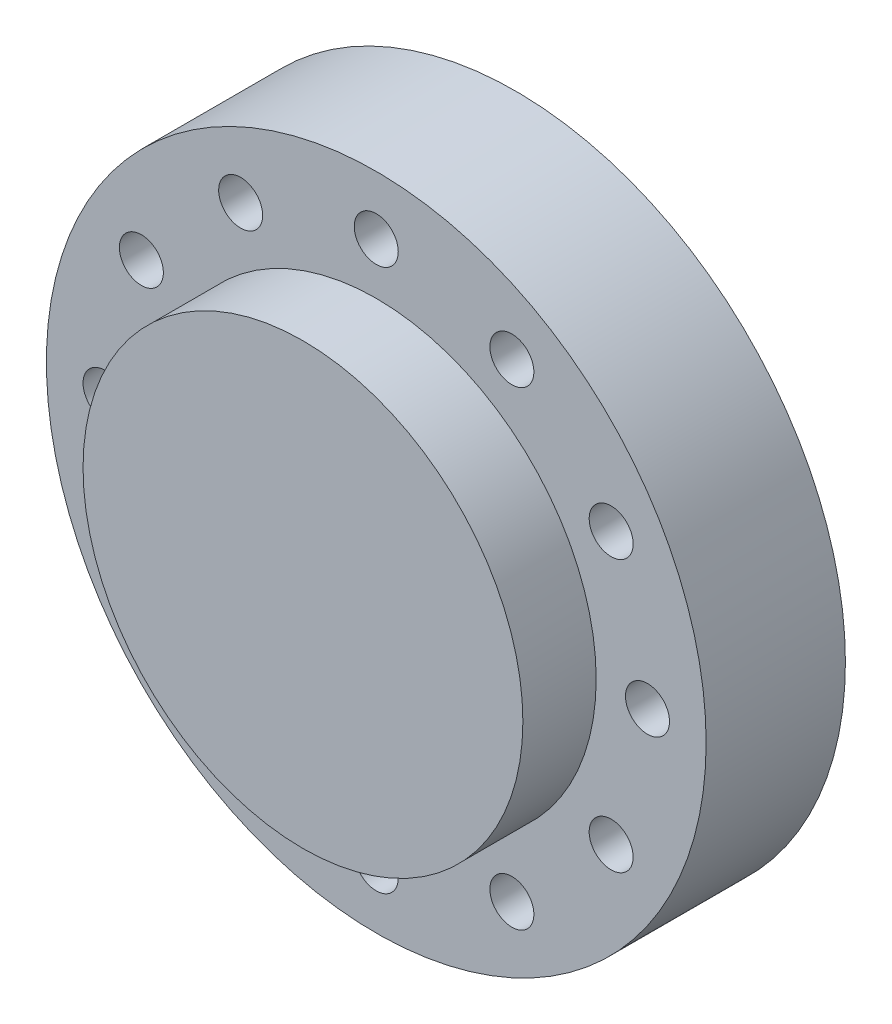
from build123d import *

# Parameters (mm, degrees)
SKETCH_1_R               = 22.5
EXTRUDE_1_DEPTH          = 9.5
SKETCH_2_R               = 15
EXTRUDE_2_DEPTH          = 5
SKETCH_3_R               = 1.5
CUT_EXTRUDE_1_DEPTH      = 5
SKETCH_5_R               = 1.5
CUT_EXTRUDE_2_DEPTH      = 34.207679835
CUT_EXTRUDE_6_DEPTH      = 3
PATTERN_CIRCULAR_1_COUNT = 12


with BuildPart() as part:
    # 草图1 → 凸台-拉伸1 (new body)
    with BuildSketch(Plane.XY):
        Circle(SKETCH_1_R)
    extrude(amount=EXTRUDE_1_DEPTH)

    # 草图2 → 凸台-拉伸2 (add)
    with BuildSketch(Plane.XY.offset(9.5)):
        Circle(SKETCH_2_R)
    extrude(amount=EXTRUDE_2_DEPTH)

    # 草图3 → 切除-拉伸1 (cut)
    with BuildSketch(Plane.XY.offset(9.5)):
        with Locations((0, 18.5)):
            Circle(SKETCH_3_R)
    cut_extrude_1 = extrude(amount=-CUT_EXTRUDE_1_DEPTH, mode=Mode.SUBTRACT)

    # 草图5 → 切除-拉伸2 (cut, through all)
    with BuildSketch(Plane.XY.offset(9.5)):
        with Locations((0, 18.5)):
            Circle(SKETCH_5_R)
    cut_extrude_2 = extrude(amount=-CUT_EXTRUDE_2_DEPTH, mode=Mode.SUBTRACT)

    # 草图9 → 切除-拉伸6 (cut)
    with BuildSketch(Plane(origin=(0, 0, 0), x_dir=(-1, 0, 0), z_dir=(0, 0, -1))):
        Polygon((1.204492644, 21.438116881), (-1.942237536, 21.012179669), (-3.14673018, 18.074062788), (-1.204492644, 15.561883119), (1.942237536, 15.987820331), (3.14673018, 18.925937212), align=None)
    cut_extrude_6 = extrude(amount=-CUT_EXTRUDE_6_DEPTH, mode=Mode.SUBTRACT)

    # 阵列(圆周)1: 切除-拉伸1, 切除-拉伸2, 切除-拉伸6 ×12 about axis
    pattern_circular_1_axis = Axis((0, 0, 0), (0, 0, 1))
    add([cut_extrude_1.rotate(pattern_circular_1_axis, i * 360 / PATTERN_CIRCULAR_1_COUNT) for i in range(1, PATTERN_CIRCULAR_1_COUNT)], mode=Mode.SUBTRACT)
    add([cut_extrude_2.rotate(pattern_circular_1_axis, i * 360 / PATTERN_CIRCULAR_1_COUNT) for i in range(1, PATTERN_CIRCULAR_1_COUNT)], mode=Mode.SUBTRACT)
    add([cut_extrude_6.rotate(pattern_circular_1_axis, i * 360 / PATTERN_CIRCULAR_1_COUNT) for i in range(1, PATTERN_CIRCULAR_1_COUNT)], mode=Mode.SUBTRACT)


solid = part.part
